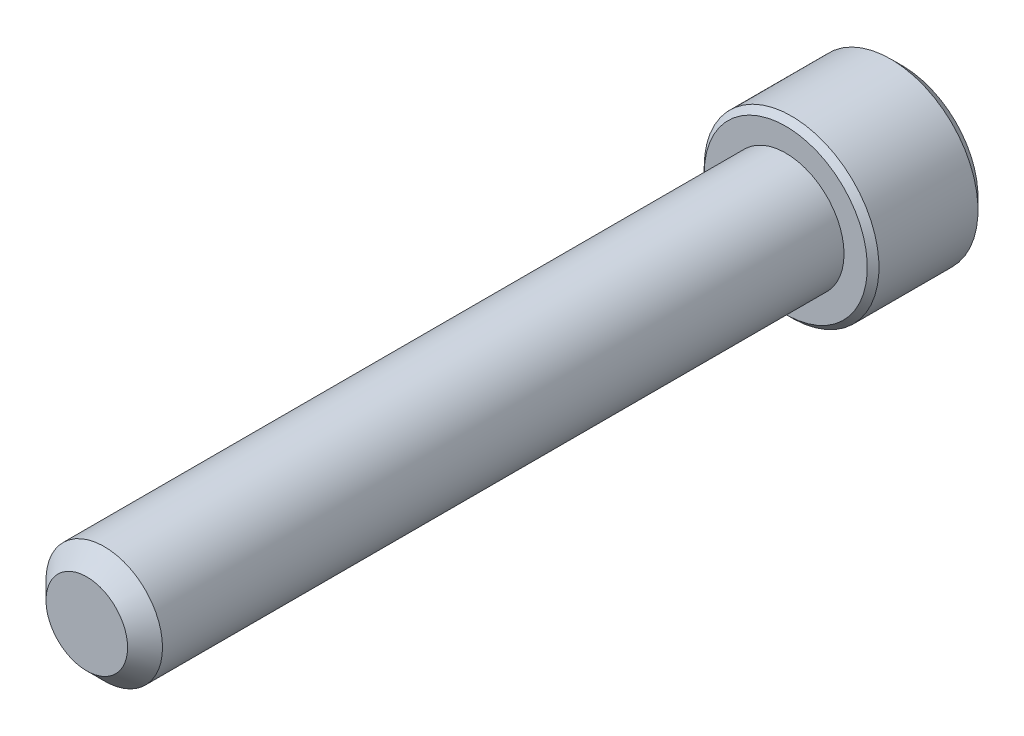
from build123d import *

# Parameters (mm, degrees)
SKETCH1_R          = 3.175
EXTRUDE1_DEPTH     = 38.1
SKETCH6_R          = 4.7625
EXTRUDE2_DEPTH     = 6.35
CUT_EXTRUDE1_DEPTH = 3.571875
SKETCH8_R          = 2.749630657
CUT_EXTRUDE2_DEPTH = 0.635
CUT_EXTRUDE2_DRAFT = -45
CHAMFER1_SIZE      = 0.635
CHAMFER2_SIZE      = 0.3175
CHAMFER3_SIZE      = 0.9525


with BuildPart() as part:
    # Sketch1 → Extrude1 (new body)
    with BuildSketch(Plane.XY):
        Circle(SKETCH1_R)
    extrude(amount=-EXTRUDE1_DEPTH)

    # Sketch6 → Extrude2 (add)
    with BuildSketch(Plane(origin=(0, 0, -38.1), x_dir=(-1, 0, 0), z_dir=(0, 0, -1))):
        Circle(SKETCH6_R)
    extrude(amount=EXTRUDE2_DEPTH)

    # Sketch7 → Cut-Extrude1 (cut)
    with BuildSketch(Plane(origin=(0, 0, -44.45), x_dir=(-1, 0, 0), z_dir=(0, 0, -1))):
        Polygon((0, 2.749630657), (-2.38125, 1.374815329), (-2.38125, -1.374815329), (0, -2.749630657), (2.38125, -1.374815329), (2.38125, 1.374815329), align=None)
    extrude(amount=-CUT_EXTRUDE1_DEPTH, mode=Mode.SUBTRACT)


with BuildPart() as cut_extrude2_tool:
    # Sketch8 → Cut-Extrude2 (with draft: the straight prism first)
    with BuildSketch(Plane(origin=(0, 0, -44.45), x_dir=(-1, 0, 0), z_dir=(0, 0, -1))):
        Circle(SKETCH8_R)
    extrude(amount=-CUT_EXTRUDE2_DEPTH)
    # Cut-Extrude2: the draft: its side faces are tilted about the plane it starts from
    cut_extrude2_sides = [cut_extrude2_tool.faces().sort_by_distance(p)[0] for p in [
        (2.749630657, 0, -44.1325),
    ]]
    draft(cut_extrude2_sides, Plane(origin=(0, 0, -44.45), x_dir=(-1, 0, 0), z_dir=(0, 0, -1)), CUT_EXTRUDE2_DRAFT)


with BuildPart() as part_1:
    add(part.part)

    # Cut-Extrude2: cut by cut_extrude2_tool
    add(cut_extrude2_tool.part, mode=Mode.SUBTRACT)

    # Chamfer1
    chamfer1_edges = [part_1.edges().sort_by_distance(p)[0] for p in [
        (4.7625, 0, -44.45),
    ]]
    chamfer(chamfer1_edges, length=CHAMFER1_SIZE)

    # Chamfer2
    chamfer2_edges = [part_1.edges().sort_by_distance(p)[0] for p in [
        (4.7625, 0, -38.1),
    ]]
    chamfer(chamfer2_edges, length=CHAMFER2_SIZE)

    # Chamfer3
    chamfer3_edges = [part_1.edges().sort_by_distance(p)[0] for p in [
        (-3.175, 0, 0),
    ]]
    chamfer(chamfer3_edges, length=CHAMFER3_SIZE)


solid = part_1.part
